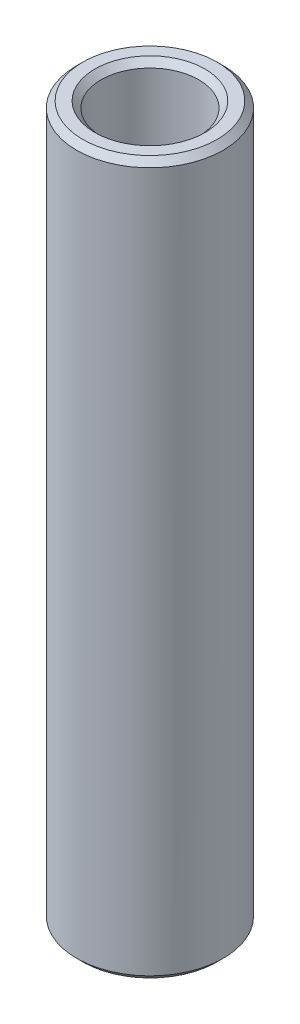
from build123d import *

# Parameters (mm, degrees)
SKETCH2_W     = 1
SKETCH2_H     = 29.1465
CHAMFER2_SIZE = 0.254


with BuildPart() as part:
    # Sketch2 → Revolve1 (revolve)
    with BuildSketch(Plane.XY, mode=Mode.PRIVATE) as revolve1_sk:
        with Locations((2.5, 0)):
            Rectangle(SKETCH2_W, SKETCH2_H)
    revolve(revolve1_sk.sketch.rotate(Axis((0, 9.961653463, 0), (0, -1, 0)), 180), axis=Axis((0, 9.961653463, 0), (0, -1, 0)))

    # Chamfer2
    chamfer2_edges = [part.edges().sort_by_distance(p)[0] for p in [
        (3, 14.57325, 0),
        (3, -14.57325, 0),
        (2, -14.57325, 0),
        (2, 14.57325, 0),
    ]]
    chamfer(chamfer2_edges, length=CHAMFER2_SIZE)


solid = part.part
